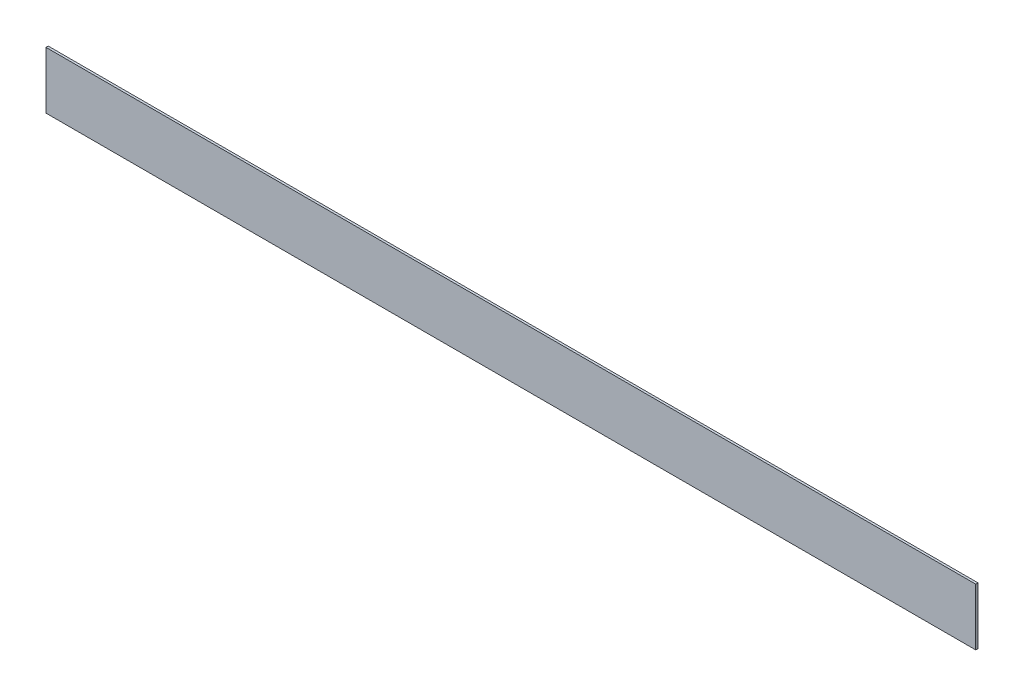
from build123d import *

# Parameters (mm, degrees)
SKETCH_1_W      = 2056
SKETCH_1_H      = 126
EXTRUDE_1_DEPTH = 5


with BuildPart() as part:
    # 草图1 → 凸台-拉伸1 (new body)
    with BuildSketch(Plane.XY):
        with Locations((1028, 63)):
            Rectangle(SKETCH_1_W, SKETCH_1_H)
    extrude(amount=EXTRUDE_1_DEPTH)


solid = part.part
